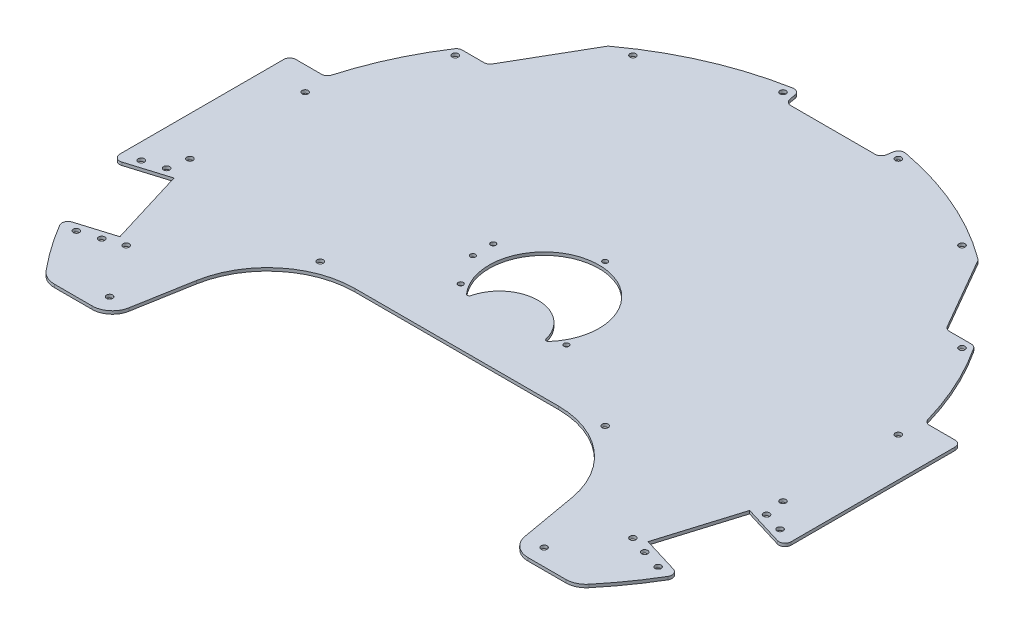
from build123d import *

# Parameters (mm, degrees)
BOSS_EXTRU_1_DEPTH           = 1.5
ESQUISSE2_R                  = 1.5
ENL_V_MAT_EXTRU_1_DEPTH      = 10
ESQUISSE3_W                  = 260.587519956
ESQUISSE3_H                  = 19.442661658
ENL_V_MAT_EXTRU_2_DEPTH      = 230.841793415
CONG_1_R                     = 10
CONG_2_R                     = 1
ESQUISSE4_R                  = 1.5
ENL_V_MAT_EXTRU_3_DEPTH      = 230.841793557
R_P_TITION_CIRCULAIRE1_COUNT = 3
R_P_TITION_CIRCULAIRE1_ANGLE = 180
ESQUISSE5_R                  = 1.5
ENL_V_MAT_EXTRU_4_DEPTH      = 230.841793557
ENL_V_MAT_EXTRU_5_DEPTH      = 230.841793557
ENL_V_MAT_EXTRU_6_DEPTH      = 225.685335667
CONG_3_R                     = 3
ESQUISSE8_R                  = 1.25
ENL_V_MAT_EXTRU_7_DEPTH      = 4
ENL_V_MAT_EXTRU_8_DEPTH      = 225.685335667
CONG_4_R                     = 3


with BuildPart() as part:
    # Esquisse1 → Boss.-Extru.1 (new body)
    with BuildSketch(Plane(origin=(0, 0, 0), x_dir=(1, 0, 0), z_dir=(0, 1, 0))):
        with BuildLine():
            Line((165, -54.556978373), (165, 55.241669751))
            Line((165, 55.241669751), (104.517749831, 160))
            Line((104.517749831, 160), (-104.517749831, 160))
            Line((-104.517749831, 160), (-165, 55.241669751))
            Line((-165, 55.241669751), (-165, -54.556978373))
            ThreePointArc((-165, -54.556978373), (-144.278322914, -96.877393783), (-112.949332972, -132.075402973))
            ThreePointArc((-112.949332972, -132.075402973), (0, -145), (112.949332972, -132.075402973))
            ThreePointArc((112.949332972, -132.075402973), (144.278322914, -96.877393783), (165, -54.556978373))
        make_face()
    extrude(amount=BOSS_EXTRU_1_DEPTH)

    # Esquisse2 → Enlèv. mat.-Extru.1 (cut)
    with BuildSketch(Plane(origin=(0, 1.5, 0), x_dir=(1, 0, 0), z_dir=(0, 1, 0))):
        with Locations(Location((-106.773123959, -106.773123959, 0), (0, 0, 270))):
            Circle(ESQUISSE2_R)
        with Locations(Location((143, -86.912961133, 0), (0, 0, 270))):
            Circle(ESQUISSE2_R)
        with Locations(Location((133.434799764, -83.996294466, 0), (0, 0, 270))):
            Circle(ESQUISSE2_R)
        with Locations(Location((147.434799764, -38.083333333, 0), (0, 0, 270))):
            Circle(ESQUISSE2_R)
        with Locations(Location((157, -41, 0), (0, 0, 270))):
            Circle(ESQUISSE2_R)
        with Locations(Location((-147.434799764, -38.083333333, 0), (0, 0, 270))):
            Circle(ESQUISSE2_R)
        with Locations(Location((-157, -41, 0), (0, 0, 270))):
            Circle(ESQUISSE2_R)
        with Locations(Location((-143, -86.912961133, 0), (0, 0, 270))):
            Circle(ESQUISSE2_R)
        with Locations(Location((-133.434799764, -83.996294466, 0), (0, 0, 270))):
            Circle(ESQUISSE2_R)
        with Locations(Location((106.773123959, -106.773123959, 0), (0, 0, 270))):
            Circle(ESQUISSE2_R)
        with BuildLine():
            Line((-92.34673338, -78.53312836), (-104.066636173, -145))
            Line((-104.066636173, -145), (104.066636173, -145))
            Line((104.066636173, -145), (92.34673338, -78.53312836))
            ThreePointArc((92.34673338, -78.53312836), (77.639867217, -53.060088946), (50, -43))
            Line((50, -43), (-50, -43))
            ThreePointArc((-50, -43), (-77.639867217, -53.060088946), (-92.34673338, -78.53312836))
        make_face()
        Polygon((141.485532979, -40.451080094), (166.980337187, -48.225077896), (155.31367052, -86.48587884), (129.818866313, -78.711881039), align=None)
        Polygon((-141.485532979, -40.451080094), (-166.980337187, -48.225077896), (-155.31367052, -86.48587884), (-129.818866313, -78.711881039), align=None)
        with BuildLine():
            ThreePointArc((18.81620543, -19.363636364), (0, -3), (-18.81620543, -19.363636364))
            ThreePointArc((-18.81620543, -19.363636364), (0, 27), (18.81620543, -19.363636364))
        make_face()
    extrude(amount=-ENL_V_MAT_EXTRU_1_DEPTH, mode=Mode.SUBTRACT)

    # Esquisse3 → Enlèv. mat.-Extru.2 (cut, through all)
    with BuildSketch(Plane(origin=(0, 1.5, 0), x_dir=(1, 0, 0), z_dir=(0, 1, 0))):
        with Locations((0, -124.721330829)):
            Rectangle(ESQUISSE3_W, ESQUISSE3_H)
    extrude(amount=-ENL_V_MAT_EXTRU_2_DEPTH, mode=Mode.SUBTRACT)

    # Congé1
    cong_1_edges = [part.edges().sort_by_distance(p)[0] for p in [
        (-165, 0.75, -55.241669751),
        (-104.517749831, 0.75, -160),
        (104.517749831, 0.75, -160),
        (165, 0.75, -55.241669751),
        (98.776826752, 0.75, 115),
        (-98.776826752, 0.75, 115),
        (-130.293759978, 0.75, 115),
        (130.293759978, 0.75, 115),
    ]]
    fillet(cong_1_edges, radius=CONG_1_R)

    # Congé2
    cong_2_edges = [part.edges().sort_by_distance(p)[0] for p in [
        (-18.81620543, 0.75, 19.363636364),
        (18.81620543, 0.75, 19.363636364),
    ]]
    fillet(cong_2_edges, radius=CONG_2_R)

    # Esquisse4 → Enlèv. mat.-Extru.3 (cut, through all)
    with BuildSketch(Plane(origin=(0, 1.5, 0), x_dir=(1, 0, 0), z_dir=(0, 1, 0))):
        with Locations(Location((-124.54257934, -80.8788967, 0), (0, 0, 270))):
            Circle(ESQUISSE4_R)
        with Locations(Location((-145.771636742, -28.335135813, 0), (0, 0, 270))):
            Circle(ESQUISSE4_R)
        with Locations(Location((-145.771636742, 28.335135813, 0), (0, 0, 270))):
            Circle(ESQUISSE4_R)
        with Locations(Location((-124.54257934, 80.8788967, 0), (0, 0, 270))):
            Circle(ESQUISSE4_R)
    enl_v_mat_extru_3 = extrude(amount=-ENL_V_MAT_EXTRU_3_DEPTH, mode=Mode.SUBTRACT)

    # Répétition circulaire1: Enlèv. mat.-Extru.3 ×3 about axis
    r_p_tition_circulaire1_axis = Axis((0, 0, 0), (0, -1, 0))
    for i in range(1, R_P_TITION_CIRCULAIRE1_COUNT):
        add(enl_v_mat_extru_3.rotate(r_p_tition_circulaire1_axis, i * R_P_TITION_CIRCULAIRE1_ANGLE / (R_P_TITION_CIRCULAIRE1_COUNT - 1)), mode=Mode.SUBTRACT)

    # Esquisse5 → Enlèv. mat.-Extru.4 (cut, through all)
    with BuildSketch(Plane(origin=(0, 1.5, 0), x_dir=(1, 0, 0), z_dir=(0, 1, 0))):
        with Locations(Location((-70, -40, 0), (0, 0, 270))):
            Circle(ESQUISSE5_R)
        with Locations(Location((70, -40, 0), (0, 0, 90))):
            Circle(ESQUISSE5_R)
    extrude(amount=-ENL_V_MAT_EXTRU_4_DEPTH, mode=Mode.SUBTRACT)

    # Esquisse6 → Enlèv. mat.-Extru.5 (cut, through all)
    with BuildSketch(Plane(origin=(0, 1.5, 0), x_dir=(1, 0, 0), z_dir=(0, 1, 0))):
        with BuildLine():
            Line((-165, 40), (-147.160626528, 40))
            ThreePointArc((-147.160626528, 40), (0, 152.5), (147.160626528, 40))
            Line((147.160626528, 40), (165, 40))
            Line((165, 40), (165, 160))
            Line((165, 160), (-165, 160))
            Line((-165, 160), (-165, 40))
        make_face()
    extrude(amount=-ENL_V_MAT_EXTRU_5_DEPTH, mode=Mode.SUBTRACT)

    # Esquisse7 → Enlèv. mat.-Extru.6 (cut, through all)
    with BuildSketch(Plane(origin=(0, 1.5, 0), x_dir=(1, 0, 0), z_dir=(0, 1, 0))):
        Polygon((126.695788782, 122.365900164), (126.695788782, 84.8788967), (112.653221515, 84.8788967), (91.010089974, 122.365900164), align=None)
        Polygon((-91.010089974, 122.365900164), (-112.653221515, 84.8788967), (-126.695788782, 84.8788967), (-126.695788782, 122.365900164), align=None)
    extrude(amount=-ENL_V_MAT_EXTRU_6_DEPTH, mode=Mode.SUBTRACT)

    # Congé3
    cong_3_edges = [part.edges().sort_by_distance(p)[0] for p in [
        (-151.413225219, 0.75, 85.296536378),
        (-165, 0.75, 47.621223996),
        (-165, 0.75, -40),
        (165, 0.75, -40),
        (147.160626528, 0.75, -40),
        (-147.160626528, 0.75, -40),
        (91.010089974, 0.75, -122.365900164),
        (126.695788782, 0.75, -84.8788967),
        (112.653221515, 0.75, -84.8788967),
        (-91.010089974, 0.75, -122.365900164),
        (-112.653221515, 0.75, -84.8788967),
        (-126.695788782, 0.75, -84.8788967),
        (165, 0.75, 47.621223996),
        (151.413225219, 0.75, 85.296536378),
    ]]
    fillet(cong_3_edges, radius=CONG_3_R)

    # Esquisse8 → Enlèv. mat.-Extru.7 (cut)
    with BuildSketch(Plane(origin=(0, 1.5, 0), x_dir=(1, 0, 0), z_dir=(0, 1, 0))):
        with Locations(Location((-35, 0, 0), (0, 0, 270))):
            Circle(ESQUISSE8_R)
        with Locations(Location((-35, 10, 0), (0, 0, 270))):
            Circle(ESQUISSE8_R)
        with Locations(Location((0, 30, 0), (0, 0, 270))):
            Circle(ESQUISSE8_R)
        with Locations(Location((25.980762114, -15, 0), (0, 0, 270))):
            Circle(ESQUISSE8_R)
        with Locations(Location((-25.980762114, -15, 0), (0, 0, 270))):
            Circle(ESQUISSE8_R)
    extrude(amount=-ENL_V_MAT_EXTRU_7_DEPTH, mode=Mode.SUBTRACT)

    # Esquisse9 → Enlèv. mat.-Extru.8 (cut, through all)
    with BuildSketch(Plane(origin=(0, 1.5, 0), x_dir=(1, 0, 0), z_dir=(0, 1, 0))):
        Polygon((-25, 152.5), (25, 152.5), (23.278688525, 142), (-23.278688525, 142), align=None)
    extrude(amount=-ENL_V_MAT_EXTRU_8_DEPTH, mode=Mode.SUBTRACT)

    # Congé4
    cong_4_edges = [part.edges().sort_by_distance(p)[0] for p in [
        (-24.670691628, 0.75, -150.491218929),
        (-23.278688525, 0.75, -142),
        (24.670691628, 0.75, -150.491218929),
        (23.278688525, 0.75, -142),
    ]]
    fillet(cong_4_edges, radius=CONG_4_R)


solid = part.part
